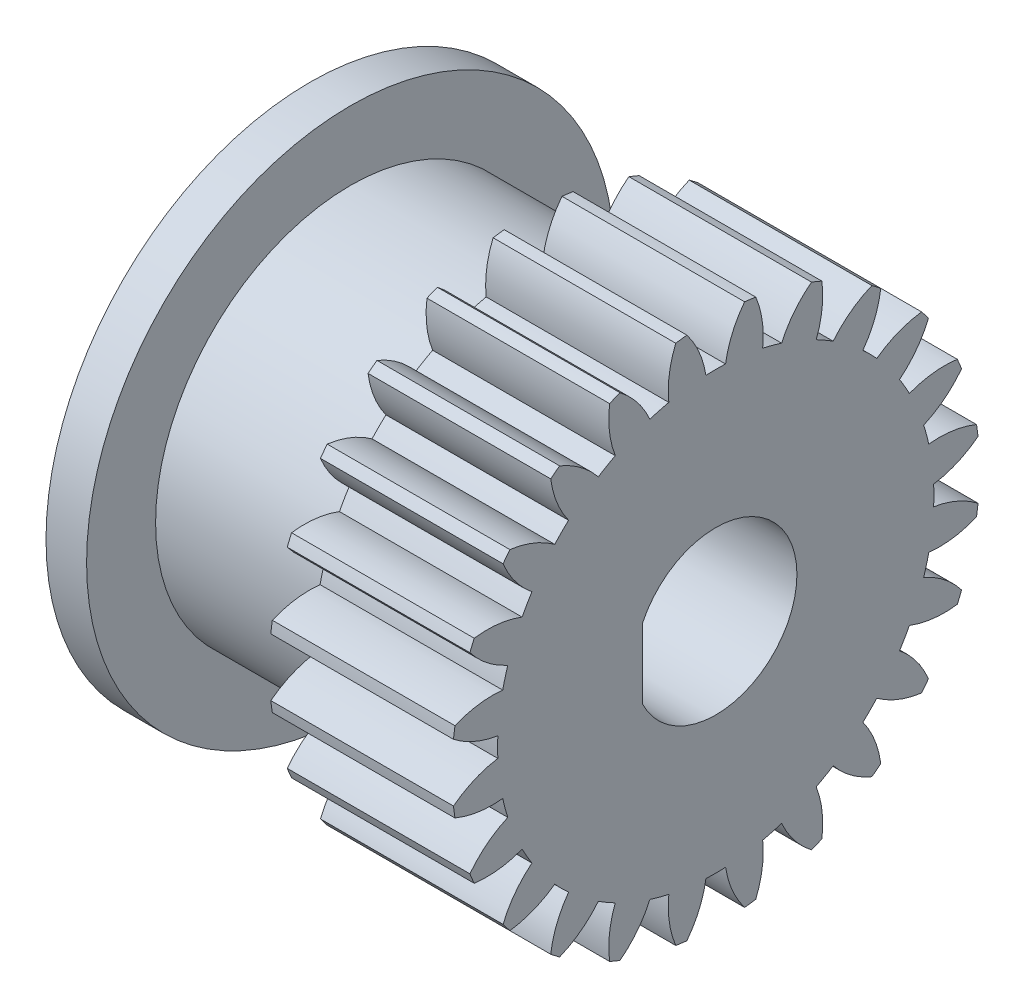
from build123d import *

# Parameters (mm, degrees)
BASPROSKE_W         = 4.5
BASPROSKE_H         = 6.5
TOOTHCUT_DEPTH      = 11.234744745
TEETHCUTS_COUNT     = 24
TEETHCUTS_ANGLE     = 345
BORSKE_R            = 1.5
BORE_DEPTH          = 50.0000508
SKETCH_1_R          = 4.8
SKETCH_1_R_2        = 1.5
EXTRUDE_1_DEPTH     = 4.5
SKETCH_2_R          = 6.5
SKETCH_2_R_2        = 1.5
EXTRUDE_2_DEPTH     = 1
CUT_EXTRUDE_1_REACH = 15.583


with BuildPart() as part:
    # BasProSke → Base-Revolve (revolve)
    with BuildSketch(Plane(origin=(0, 0, 0), x_dir=(1, 0, 0), z_dir=(0, 1, 0)), mode=Mode.PRIVATE) as base_revolve_sk:
        with Locations((2.25, 3.25)):
            Rectangle(BASPROSKE_W, BASPROSKE_H)
    revolve(base_revolve_sk.sketch.rotate(Axis((-10, 0, 0), (1, 0, 0)), 180), axis=Axis((-10, 0, 0), (1, 0, 0)))

    # TooCutSke → ToothCut (cut, through all)
    with BuildSketch(Plane(origin=(0, 0, 0), x_dir=(0, 0, -1), z_dir=(1, 0, 0))):
        with BuildLine():
            ThreePointArc((0.241646108, 5.368564348), (0, 5.374), (-0.241646108, 5.368564348))
            ThreePointArc((-0.241646108, 5.368564348), (-0.413699957, 5.957993365), (-0.729686037, 6.48447403))
            ThreePointArc((-0.729686037, 6.48447403), (0, 6.5254), (0.729686037, 6.48447403))
            ThreePointArc((0.729686037, 6.48447403), (0.413699957, 5.957993365), (0.241646108, 5.368564348))
        make_face()
    toothcut = extrude(amount=TOOTHCUT_DEPTH, mode=Mode.SUBTRACT)

    # TeethCuts: ToothCut ×24 about axis
    teethcuts_axis = Axis((-10, 0, 0), (1, 0, 0))
    for i in range(1, TEETHCUTS_COUNT):
        add(toothcut.rotate(teethcuts_axis, i * TEETHCUTS_ANGLE / (TEETHCUTS_COUNT - 1)), mode=Mode.SUBTRACT)

    # BorSke → Bore (cut, symmetric)
    with BuildSketch(Plane(origin=(0, 0, 0), x_dir=(0, 0, -1), z_dir=(1, 0, 0))):
        with Locations(Location((0, 0, 0), (0, 0, 180))):
            Circle(BORSKE_R)
    extrude(amount=BORE_DEPTH, both=True, mode=Mode.SUBTRACT)

    # 草图1 → 凸台-拉伸1 (add)
    with BuildSketch(Plane.ZY):
        with Locations(Location((0, 0, 0), (0, 0, 180))):
            Circle(SKETCH_1_R)
        Circle(SKETCH_1_R_2, mode=Mode.SUBTRACT)
    extrude(amount=EXTRUDE_1_DEPTH)

    # 草图2 → 凸台-拉伸2 (add)
    with BuildSketch(Plane.ZY.offset(4.5)):
        Circle(SKETCH_2_R)
        Circle(SKETCH_2_R_2, mode=Mode.SUBTRACT)
    extrude(amount=EXTRUDE_2_DEPTH)

    # 草图3 → 切除-拉伸1 (cut, up to next)
    with BuildSketch(Plane.ZY.offset(5.5), mode=Mode.PRIVATE) as cut_extrude_1_sk1:
        with BuildLine():
            Line((1.8, -0.871779789), (1.8, 0.871779789))
            ThreePointArc((1.8, 0.871779789), (-2, 0), (1.8, -0.871779789))
        make_face()
    cut_extrude_1_tool1 = extrude(cut_extrude_1_sk1.sketch, amount=-CUT_EXTRUDE_1_REACH, mode=Mode.PRIVATE) & part.part
    add(cut_extrude_1_tool1.solids().sort_by_distance((-5.5, 0, -0.035819))[0], mode=Mode.SUBTRACT)


solid = part.part
